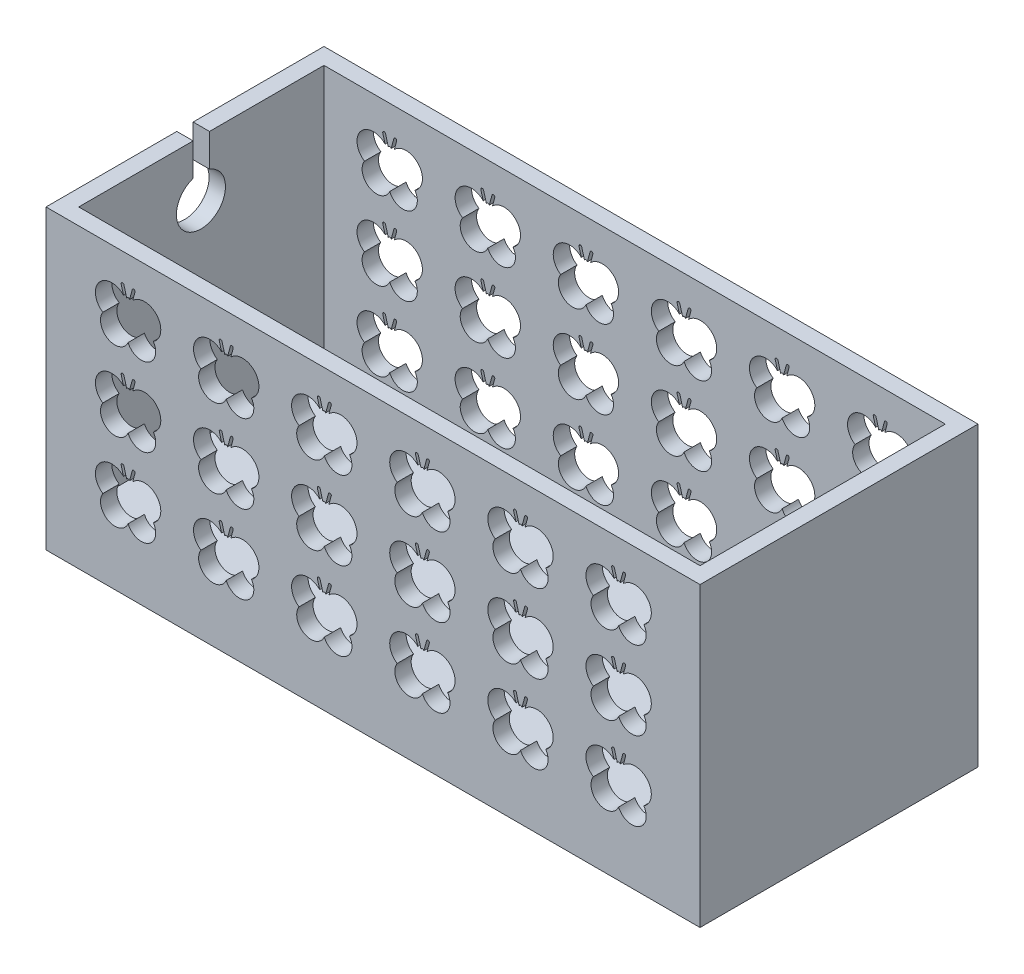
from build123d import *

# Parameters (mm, degrees)
SKETCH3_W           = 127
SKETCH3_H           = 53.975
BOSS_EXTRUDE1_DEPTH = 53.975
SKETCH4_W           = 120.65
SKETCH4_H           = 47.625
CUT_EXTRUDE2_DEPTH  = 50.8
CUT_EXTRUDE3_DEPTH  = 3.175
CUT_EXTRUDE7_DEPTH  = 100.291748147
SKETCH13_W          = 127
SKETCH13_H          = 53.975
BOSS_EXTRUDE2_DEPTH = 3.703185148
SKETCH14_R          = 2.9845
CUT_EXTRUDE9_DEPTH  = 3.81
SKETCH16_R          = 1.905
CUT_EXTRUDE11_DEPTH = 25.4


with BuildPart() as part:
    # Sketch3 → Boss-Extrude1 (new body)
    with BuildSketch(Plane(origin=(0, 0, 0), x_dir=(1, 0, 0), z_dir=(0, 1, 0))):
        Rectangle(SKETCH3_W, SKETCH3_H)
    extrude(amount=BOSS_EXTRUDE1_DEPTH)

    # Sketch4 → Cut-Extrude2 (cut)
    with BuildSketch(Plane(origin=(0, 53.975, 0), x_dir=(1, 0, 0), z_dir=(0, 1, 0))):
        Rectangle(SKETCH4_W, SKETCH4_H)
    extrude(amount=-CUT_EXTRUDE2_DEPTH, mode=Mode.SUBTRACT)

    # Sketch8 → Cut-Extrude3 (cut)
    with BuildSketch(Plane.ZY.offset(63.5)):
        with BuildLine():
            Line((-1.5875, 66.675), (1.5875, 66.675))
            Line((1.5875, 66.675), (1.5875, 47.681610838))
            ThreePointArc((1.5875, 47.681610838), (0.164948263, 38.402236989), (-1.5875, 47.625))
            Line((-1.5875, 47.625), (-1.5875, 66.675))
        make_face()
    extrude(amount=-CUT_EXTRUDE3_DEPTH, mode=Mode.SUBTRACT)

    # Sketch9 → Cut-Extrude7 (cut, through all)
    with BuildSketch(Plane.XY.offset(26.9875)):
        with BuildLine():
            Line((-28.232370407, 46.507228502), (-27.694284724, 48.468033881))
            ThreePointArc((-27.694284724, 48.468033881), (-27.352778791, 48.662467014), (-27.158345658, 48.320961081))
            Line((-27.158345658, 48.320961081), (-27.614460727, 46.658859842))
            ThreePointArc((-27.614460727, 46.658859842), (-22.881155853, 46.466264574), (-23.607800863, 41.785104996))
            ThreePointArc((-23.607800863, 41.785104996), (-24.617050214, 37.78905272), (-28.508767149, 39.14609264))
            ThreePointArc((-28.508767149, 39.14609264), (-32.400484084, 37.78905272), (-33.409733434, 41.785104996))
            ThreePointArc((-33.409733434, 41.785104996), (-34.136378444, 46.466264574), (-29.40307357, 46.658859842))
            Line((-29.40307357, 46.658859842), (-29.859188639, 48.320961081))
            ThreePointArc((-29.859188639, 48.320961081), (-29.664755507, 48.662467014), (-29.323249574, 48.468033881))
            Line((-29.323249574, 48.468033881), (-28.785163891, 46.507228502))
            ThreePointArc((-28.785163891, 46.507228502), (-28.508767149, 46.711414297), (-28.232370407, 46.507228502))
        make_face()
        with BuildLine():
            Line((-9.182370407, 46.507228502), (-8.644284724, 48.468033881))
            ThreePointArc((-8.644284724, 48.468033881), (-8.302778791, 48.662467014), (-8.108345658, 48.320961081))
            Line((-8.108345658, 48.320961081), (-8.564460727, 46.658859842))
            ThreePointArc((-8.564460727, 46.658859842), (-3.831155853, 46.466264574), (-4.557800863, 41.785104996))
            ThreePointArc((-4.557800863, 41.785104996), (-5.567050214, 37.78905272), (-9.458767149, 39.14609264))
            ThreePointArc((-9.458767149, 39.14609264), (-13.350484084, 37.78905272), (-14.359733434, 41.785104996))
            ThreePointArc((-14.359733434, 41.785104996), (-15.086378444, 46.466264574), (-10.35307357, 46.658859842))
            Line((-10.35307357, 46.658859842), (-10.809188639, 48.320961081))
            ThreePointArc((-10.809188639, 48.320961081), (-10.614755507, 48.662467014), (-10.273249574, 48.468033881))
            Line((-10.273249574, 48.468033881), (-9.735163891, 46.507228502))
            ThreePointArc((-9.735163891, 46.507228502), (-9.458767149, 46.711414297), (-9.182370407, 46.507228502))
        make_face()
        with BuildLine():
            Line((-47.282370407, 46.507228502), (-46.744284724, 48.468033881))
            ThreePointArc((-46.744284724, 48.468033881), (-46.402778791, 48.662467014), (-46.208345658, 48.320961081))
            Line((-46.208345658, 48.320961081), (-46.664460727, 46.658859842))
            ThreePointArc((-46.664460727, 46.658859842), (-41.931155853, 46.466264574), (-42.657800863, 41.785104996))
            ThreePointArc((-42.657800863, 41.785104996), (-43.667050214, 37.78905272), (-47.558767149, 39.14609264))
            ThreePointArc((-47.558767149, 39.14609264), (-51.450484084, 37.78905272), (-52.459733434, 41.785104996))
            ThreePointArc((-52.459733434, 41.785104996), (-53.186378444, 46.466264574), (-48.45307357, 46.658859842))
            Line((-48.45307357, 46.658859842), (-48.909188639, 48.320961081))
            ThreePointArc((-48.909188639, 48.320961081), (-48.714755507, 48.662467014), (-48.373249574, 48.468033881))
            Line((-48.373249574, 48.468033881), (-47.835163891, 46.507228502))
            ThreePointArc((-47.835163891, 46.507228502), (-47.558767149, 46.711414297), (-47.282370407, 46.507228502))
        make_face()
        with BuildLine():
            Line((9.867629593, 46.507228502), (10.405715276, 48.468033881))
            ThreePointArc((10.405715276, 48.468033881), (10.747221209, 48.662467014), (10.941654342, 48.320961081))
            Line((10.941654342, 48.320961081), (10.485539273, 46.658859842))
            ThreePointArc((10.485539273, 46.658859842), (15.218844147, 46.466264574), (14.492199137, 41.785104996))
            ThreePointArc((14.492199137, 41.785104996), (13.482949786, 37.78905272), (9.591232851, 39.14609264))
            ThreePointArc((9.591232851, 39.14609264), (5.699515916, 37.78905272), (4.690266566, 41.785104996))
            ThreePointArc((4.690266566, 41.785104996), (3.963621556, 46.466264574), (8.69692643, 46.658859842))
            Line((8.69692643, 46.658859842), (8.240811361, 48.320961081))
            ThreePointArc((8.240811361, 48.320961081), (8.435244493, 48.662467014), (8.776750426, 48.468033881))
            Line((8.776750426, 48.468033881), (9.314836109, 46.507228502))
            ThreePointArc((9.314836109, 46.507228502), (9.591232851, 46.711414297), (9.867629593, 46.507228502))
        make_face()
        with BuildLine():
            Line((28.917629593, 46.507228502), (29.455715276, 48.468033881))
            ThreePointArc((29.455715276, 48.468033881), (29.797221209, 48.662467014), (29.991654342, 48.320961081))
            Line((29.991654342, 48.320961081), (29.535539273, 46.658859842))
            ThreePointArc((29.535539273, 46.658859842), (34.268844147, 46.466264574), (33.542199137, 41.785104996))
            ThreePointArc((33.542199137, 41.785104996), (32.532949786, 37.78905272), (28.641232851, 39.14609264))
            ThreePointArc((28.641232851, 39.14609264), (24.749515916, 37.78905272), (23.740266566, 41.785104996))
            ThreePointArc((23.740266566, 41.785104996), (23.013621556, 46.466264574), (27.74692643, 46.658859842))
            Line((27.74692643, 46.658859842), (27.290811361, 48.320961081))
            ThreePointArc((27.290811361, 48.320961081), (27.485244493, 48.662467014), (27.826750426, 48.468033881))
            Line((27.826750426, 48.468033881), (28.364836109, 46.507228502))
            ThreePointArc((28.364836109, 46.507228502), (28.641232851, 46.711414297), (28.917629593, 46.507228502))
        make_face()
        with BuildLine():
            Line((47.967629593, 46.507228502), (48.505715276, 48.468033881))
            ThreePointArc((48.505715276, 48.468033881), (48.847221209, 48.662467014), (49.041654342, 48.320961081))
            Line((49.041654342, 48.320961081), (48.585539273, 46.658859842))
            ThreePointArc((48.585539273, 46.658859842), (53.318844147, 46.466264574), (52.592199137, 41.785104996))
            ThreePointArc((52.592199137, 41.785104996), (51.582949786, 37.78905272), (47.691232851, 39.14609264))
            ThreePointArc((47.691232851, 39.14609264), (43.799515916, 37.78905272), (42.790266566, 41.785104996))
            ThreePointArc((42.790266566, 41.785104996), (42.063621556, 46.466264574), (46.79692643, 46.658859842))
            Line((46.79692643, 46.658859842), (46.340811361, 48.320961081))
            ThreePointArc((46.340811361, 48.320961081), (46.535244493, 48.662467014), (46.876750426, 48.468033881))
            Line((46.876750426, 48.468033881), (47.414836109, 46.507228502))
            ThreePointArc((47.414836109, 46.507228502), (47.691232851, 46.711414297), (47.967629593, 46.507228502))
        make_face()
        with BuildLine():
            Line((-28.232370407, 31.267228502), (-27.694284724, 33.228033881))
            ThreePointArc((-27.694284724, 33.228033881), (-27.352778791, 33.422467014), (-27.158345658, 33.080961081))
            Line((-27.158345658, 33.080961081), (-27.614460727, 31.418859842))
            ThreePointArc((-27.614460727, 31.418859842), (-22.881155853, 31.226264574), (-23.607800863, 26.545104996))
            ThreePointArc((-23.607800863, 26.545104996), (-24.617050214, 22.54905272), (-28.508767149, 23.90609264))
            ThreePointArc((-28.508767149, 23.90609264), (-32.400484084, 22.54905272), (-33.409733434, 26.545104996))
            ThreePointArc((-33.409733434, 26.545104996), (-34.136378444, 31.226264574), (-29.40307357, 31.418859842))
            Line((-29.40307357, 31.418859842), (-29.859188639, 33.080961081))
            ThreePointArc((-29.859188639, 33.080961081), (-29.664755507, 33.422467014), (-29.323249574, 33.228033881))
            Line((-29.323249574, 33.228033881), (-28.785163891, 31.267228502))
            ThreePointArc((-28.785163891, 31.267228502), (-28.508767149, 31.471414297), (-28.232370407, 31.267228502))
        make_face()
        with BuildLine():
            Line((-9.182370407, 31.267228502), (-8.644284724, 33.228033881))
            ThreePointArc((-8.644284724, 33.228033881), (-8.302778791, 33.422467014), (-8.108345658, 33.080961081))
            Line((-8.108345658, 33.080961081), (-8.564460727, 31.418859842))
            ThreePointArc((-8.564460727, 31.418859842), (-3.831155853, 31.226264574), (-4.557800863, 26.545104996))
            ThreePointArc((-4.557800863, 26.545104996), (-5.567050214, 22.54905272), (-9.458767149, 23.90609264))
            ThreePointArc((-9.458767149, 23.90609264), (-13.350484084, 22.54905272), (-14.359733434, 26.545104996))
            ThreePointArc((-14.359733434, 26.545104996), (-15.086378444, 31.226264574), (-10.35307357, 31.418859842))
            Line((-10.35307357, 31.418859842), (-10.809188639, 33.080961081))
            ThreePointArc((-10.809188639, 33.080961081), (-10.614755507, 33.422467014), (-10.273249574, 33.228033881))
            Line((-10.273249574, 33.228033881), (-9.735163891, 31.267228502))
            ThreePointArc((-9.735163891, 31.267228502), (-9.458767149, 31.471414297), (-9.182370407, 31.267228502))
        make_face()
        with BuildLine():
            Line((9.867629593, 31.267228502), (10.405715276, 33.228033881))
            ThreePointArc((10.405715276, 33.228033881), (10.747221209, 33.422467014), (10.941654342, 33.080961081))
            Line((10.941654342, 33.080961081), (10.485539273, 31.418859842))
            ThreePointArc((10.485539273, 31.418859842), (15.218844147, 31.226264574), (14.492199137, 26.545104996))
            ThreePointArc((14.492199137, 26.545104996), (13.482949786, 22.54905272), (9.591232851, 23.90609264))
            ThreePointArc((9.591232851, 23.90609264), (5.699515916, 22.54905272), (4.690266566, 26.545104996))
            ThreePointArc((4.690266566, 26.545104996), (3.963621556, 31.226264574), (8.69692643, 31.418859842))
            Line((8.69692643, 31.418859842), (8.240811361, 33.080961081))
            ThreePointArc((8.240811361, 33.080961081), (8.435244493, 33.422467014), (8.776750426, 33.228033881))
            Line((8.776750426, 33.228033881), (9.314836109, 31.267228502))
            ThreePointArc((9.314836109, 31.267228502), (9.591232851, 31.471414297), (9.867629593, 31.267228502))
        make_face()
        with BuildLine():
            Line((28.917629593, 31.267228502), (29.455715276, 33.228033881))
            ThreePointArc((29.455715276, 33.228033881), (29.797221209, 33.422467014), (29.991654342, 33.080961081))
            Line((29.991654342, 33.080961081), (29.535539273, 31.418859842))
            ThreePointArc((29.535539273, 31.418859842), (34.268844147, 31.226264574), (33.542199137, 26.545104996))
            ThreePointArc((33.542199137, 26.545104996), (32.532949786, 22.54905272), (28.641232851, 23.90609264))
            ThreePointArc((28.641232851, 23.90609264), (24.749515916, 22.54905272), (23.740266566, 26.545104996))
            ThreePointArc((23.740266566, 26.545104996), (23.013621556, 31.226264574), (27.74692643, 31.418859842))
            Line((27.74692643, 31.418859842), (27.290811361, 33.080961081))
            ThreePointArc((27.290811361, 33.080961081), (27.485244493, 33.422467014), (27.826750426, 33.228033881))
            Line((27.826750426, 33.228033881), (28.364836109, 31.267228502))
            ThreePointArc((28.364836109, 31.267228502), (28.641232851, 31.471414297), (28.917629593, 31.267228502))
        make_face()
        with BuildLine():
            Line((47.967629593, 31.267228502), (48.505715276, 33.228033881))
            ThreePointArc((48.505715276, 33.228033881), (48.847221209, 33.422467014), (49.041654342, 33.080961081))
            Line((49.041654342, 33.080961081), (48.585539273, 31.418859842))
            ThreePointArc((48.585539273, 31.418859842), (53.318844147, 31.226264574), (52.592199137, 26.545104996))
            ThreePointArc((52.592199137, 26.545104996), (51.582949786, 22.54905272), (47.691232851, 23.90609264))
            ThreePointArc((47.691232851, 23.90609264), (43.799515916, 22.54905272), (42.790266566, 26.545104996))
            ThreePointArc((42.790266566, 26.545104996), (42.063621556, 31.226264574), (46.79692643, 31.418859842))
            Line((46.79692643, 31.418859842), (46.340811361, 33.080961081))
            ThreePointArc((46.340811361, 33.080961081), (46.535244493, 33.422467014), (46.876750426, 33.228033881))
            Line((46.876750426, 33.228033881), (47.414836109, 31.267228502))
            ThreePointArc((47.414836109, 31.267228502), (47.691232851, 31.471414297), (47.967629593, 31.267228502))
        make_face()
        with BuildLine():
            Line((-28.232370407, 16.027228502), (-27.694284724, 17.988033881))
            ThreePointArc((-27.694284724, 17.988033881), (-27.352778791, 18.182467014), (-27.158345658, 17.840961081))
            Line((-27.158345658, 17.840961081), (-27.614460727, 16.178859842))
            ThreePointArc((-27.614460727, 16.178859842), (-22.881155853, 15.986264574), (-23.607800863, 11.305104996))
            ThreePointArc((-23.607800863, 11.305104996), (-24.617050214, 7.30905272), (-28.508767149, 8.66609264))
            ThreePointArc((-28.508767149, 8.66609264), (-32.400484084, 7.30905272), (-33.409733434, 11.305104996))
            ThreePointArc((-33.409733434, 11.305104996), (-34.136378444, 15.986264574), (-29.40307357, 16.178859842))
            Line((-29.40307357, 16.178859842), (-29.859188639, 17.840961081))
            ThreePointArc((-29.859188639, 17.840961081), (-29.664755507, 18.182467014), (-29.323249574, 17.988033881))
            Line((-29.323249574, 17.988033881), (-28.785163891, 16.027228502))
            ThreePointArc((-28.785163891, 16.027228502), (-28.508767149, 16.231414297), (-28.232370407, 16.027228502))
        make_face()
        with BuildLine():
            Line((-9.182370407, 16.027228502), (-8.644284724, 17.988033881))
            ThreePointArc((-8.644284724, 17.988033881), (-8.302778791, 18.182467014), (-8.108345658, 17.840961081))
            Line((-8.108345658, 17.840961081), (-8.564460727, 16.178859842))
            ThreePointArc((-8.564460727, 16.178859842), (-3.831155853, 15.986264574), (-4.557800863, 11.305104996))
            ThreePointArc((-4.557800863, 11.305104996), (-5.567050214, 7.30905272), (-9.458767149, 8.66609264))
            ThreePointArc((-9.458767149, 8.66609264), (-13.350484084, 7.30905272), (-14.359733434, 11.305104996))
            ThreePointArc((-14.359733434, 11.305104996), (-15.086378444, 15.986264574), (-10.35307357, 16.178859842))
            Line((-10.35307357, 16.178859842), (-10.809188639, 17.840961081))
            ThreePointArc((-10.809188639, 17.840961081), (-10.614755507, 18.182467014), (-10.273249574, 17.988033881))
            Line((-10.273249574, 17.988033881), (-9.735163891, 16.027228502))
            ThreePointArc((-9.735163891, 16.027228502), (-9.458767149, 16.231414297), (-9.182370407, 16.027228502))
        make_face()
        with BuildLine():
            Line((9.867629593, 16.027228502), (10.405715276, 17.988033881))
            ThreePointArc((10.405715276, 17.988033881), (10.747221209, 18.182467014), (10.941654342, 17.840961081))
            Line((10.941654342, 17.840961081), (10.485539273, 16.178859842))
            ThreePointArc((10.485539273, 16.178859842), (15.218844147, 15.986264574), (14.492199137, 11.305104996))
            ThreePointArc((14.492199137, 11.305104996), (13.482949786, 7.30905272), (9.591232851, 8.66609264))
            ThreePointArc((9.591232851, 8.66609264), (5.699515916, 7.30905272), (4.690266566, 11.305104996))
            ThreePointArc((4.690266566, 11.305104996), (3.963621556, 15.986264574), (8.69692643, 16.178859842))
            Line((8.69692643, 16.178859842), (8.240811361, 17.840961081))
            ThreePointArc((8.240811361, 17.840961081), (8.435244493, 18.182467014), (8.776750426, 17.988033881))
            Line((8.776750426, 17.988033881), (9.314836109, 16.027228502))
            ThreePointArc((9.314836109, 16.027228502), (9.591232851, 16.231414297), (9.867629593, 16.027228502))
        make_face()
        with BuildLine():
            Line((28.917629593, 16.027228502), (29.455715276, 17.988033881))
            ThreePointArc((29.455715276, 17.988033881), (29.797221209, 18.182467014), (29.991654342, 17.840961081))
            Line((29.991654342, 17.840961081), (29.535539273, 16.178859842))
            ThreePointArc((29.535539273, 16.178859842), (34.268844147, 15.986264574), (33.542199137, 11.305104996))
            ThreePointArc((33.542199137, 11.305104996), (32.532949786, 7.30905272), (28.641232851, 8.66609264))
            ThreePointArc((28.641232851, 8.66609264), (24.749515916, 7.30905272), (23.740266566, 11.305104996))
            ThreePointArc((23.740266566, 11.305104996), (23.013621556, 15.986264574), (27.74692643, 16.178859842))
            Line((27.74692643, 16.178859842), (27.290811361, 17.840961081))
            ThreePointArc((27.290811361, 17.840961081), (27.485244493, 18.182467014), (27.826750426, 17.988033881))
            Line((27.826750426, 17.988033881), (28.364836109, 16.027228502))
            ThreePointArc((28.364836109, 16.027228502), (28.641232851, 16.231414297), (28.917629593, 16.027228502))
        make_face()
        with BuildLine():
            Line((47.967629593, 16.027228502), (48.505715276, 17.988033881))
            ThreePointArc((48.505715276, 17.988033881), (48.847221209, 18.182467014), (49.041654342, 17.840961081))
            Line((49.041654342, 17.840961081), (48.585539273, 16.178859842))
            ThreePointArc((48.585539273, 16.178859842), (53.318844147, 15.986264574), (52.592199137, 11.305104996))
            ThreePointArc((52.592199137, 11.305104996), (51.582949786, 7.30905272), (47.691232851, 8.66609264))
            ThreePointArc((47.691232851, 8.66609264), (43.799515916, 7.30905272), (42.790266566, 11.305104996))
            ThreePointArc((42.790266566, 11.305104996), (42.063621556, 15.986264574), (46.79692643, 16.178859842))
            Line((46.79692643, 16.178859842), (46.340811361, 17.840961081))
            ThreePointArc((46.340811361, 17.840961081), (46.535244493, 18.182467014), (46.876750426, 17.988033881))
            Line((46.876750426, 17.988033881), (47.414836109, 16.027228502))
            ThreePointArc((47.414836109, 16.027228502), (47.691232851, 16.231414297), (47.967629593, 16.027228502))
        make_face()
        with BuildLine():
            Line((-47.282370407, 31.267228502), (-46.744284724, 33.228033881))
            ThreePointArc((-46.744284724, 33.228033881), (-46.402778791, 33.422467014), (-46.208345658, 33.080961081))
            Line((-46.208345658, 33.080961081), (-46.664460727, 31.418859842))
            ThreePointArc((-46.664460727, 31.418859842), (-41.931155853, 31.226264574), (-42.657800863, 26.545104996))
            ThreePointArc((-42.657800863, 26.545104996), (-43.667050214, 22.54905272), (-47.558767149, 23.90609264))
            ThreePointArc((-47.558767149, 23.90609264), (-51.450484084, 22.54905272), (-52.459733434, 26.545104996))
            ThreePointArc((-52.459733434, 26.545104996), (-53.186378444, 31.226264574), (-48.45307357, 31.418859842))
            Line((-48.45307357, 31.418859842), (-48.909188639, 33.080961081))
            ThreePointArc((-48.909188639, 33.080961081), (-48.714755507, 33.422467014), (-48.373249574, 33.228033881))
            Line((-48.373249574, 33.228033881), (-47.835163891, 31.267228502))
            ThreePointArc((-47.835163891, 31.267228502), (-47.558767149, 31.471414297), (-47.282370407, 31.267228502))
        make_face()
        with BuildLine():
            Line((-47.282370407, 16.027228502), (-46.744284724, 17.988033881))
            ThreePointArc((-46.744284724, 17.988033881), (-46.402778791, 18.182467014), (-46.208345658, 17.840961081))
            Line((-46.208345658, 17.840961081), (-46.664460727, 16.178859842))
            ThreePointArc((-46.664460727, 16.178859842), (-41.931155853, 15.986264574), (-42.657800863, 11.305104996))
            ThreePointArc((-42.657800863, 11.305104996), (-43.667050214, 7.30905272), (-47.558767149, 8.66609264))
            ThreePointArc((-47.558767149, 8.66609264), (-51.450484084, 7.30905272), (-52.459733434, 11.305104996))
            ThreePointArc((-52.459733434, 11.305104996), (-53.186378444, 15.986264574), (-48.45307357, 16.178859842))
            Line((-48.45307357, 16.178859842), (-48.909188639, 17.840961081))
            ThreePointArc((-48.909188639, 17.840961081), (-48.714755507, 18.182467014), (-48.373249574, 17.988033881))
            Line((-48.373249574, 17.988033881), (-47.835163891, 16.027228502))
            ThreePointArc((-47.835163891, 16.027228502), (-47.558767149, 16.231414297), (-47.282370407, 16.027228502))
        make_face()
    extrude(amount=-CUT_EXTRUDE7_DEPTH, mode=Mode.SUBTRACT)

    # Sketch13 → Boss-Extrude2 (add)
    with BuildSketch(Plane.XZ):
        Rectangle(SKETCH13_W, SKETCH13_H)
    extrude(amount=BOSS_EXTRUDE2_DEPTH)

    # Sketch14 → Cut-Extrude9 (cut)
    with BuildSketch(Plane(origin=(0, 3.175, 0), x_dir=(1, 0, 0), z_dir=(0, 1, 0))):
        with Locations(Location((-31.75, 8, 0), (0, 0, 270))):
            Circle(SKETCH14_R)
        with Locations(Location((-31.749998494, -8, 0), (0, 0, 270))):
            Circle(SKETCH14_R)
        with Locations(Location((34.924998494, 8, 0), (0, 0, 270))):
            Circle(SKETCH14_R)
        with Locations(Location((34.925, -8, 0), (0, 0, 270))):
            Circle(SKETCH14_R)
    extrude(amount=-CUT_EXTRUDE9_DEPTH, mode=Mode.SUBTRACT)

    # Sketch16 → Cut-Extrude11 (cut)
    with BuildSketch(Plane(origin=(0, -0.635, 0), x_dir=(1, 0, 0), z_dir=(0, 1, 0))):
        with Locations(Location((-31.75, 8, 0), (0, 0, 270))):
            Circle(SKETCH16_R)
        with Locations(Location((-31.749998494, -8, 0), (0, 0, 270))):
            Circle(SKETCH16_R)
        with Locations(Location((34.925, -8, 0), (0, 0, 270))):
            Circle(SKETCH16_R)
        with Locations(Location((34.924998494, 8, 0), (0, 0, 270))):
            Circle(SKETCH16_R)
    extrude(amount=-CUT_EXTRUDE11_DEPTH, mode=Mode.SUBTRACT)


solid = part.part
